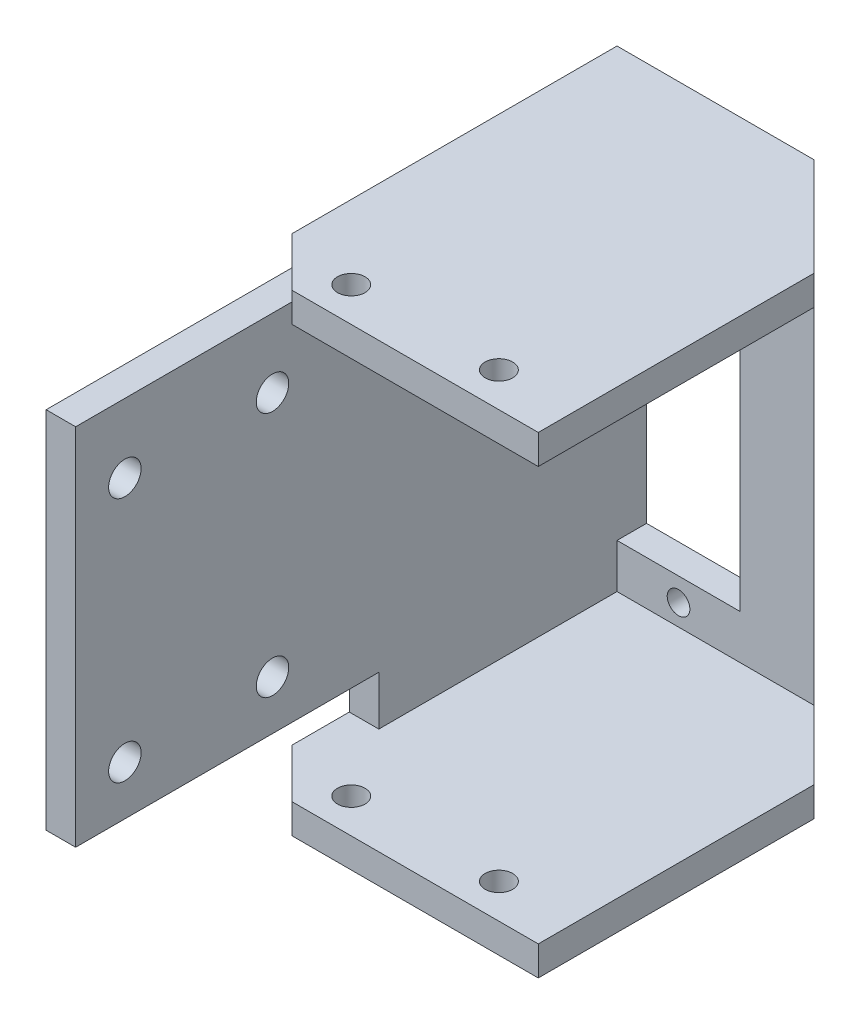
from build123d import *

# Parameters (mm, degrees)
SKETCH_1_W           = 30
SKETCH_1_H           = 48
EXTRUDE_1_DEPTH      = 3
SKETCH_3_W           = 30
SKETCH_3_H           = 3
EXTRUDE_2_DEPTH      = 35
CUT_EXTRUDE_2_DEPTH  = 69.176242196
CUT_EXTRUDE_3_DEPTH  = 69.176242196
SKETCH_7_W           = 3
SKETCH_7_H           = 42
EXTRUDE_3_DEPTH      = 25
SKETCH_14_W          = 3
SKETCH_14_H          = 42
EXTRUDE_6_DEPTH      = 30
SKETCH_15_R          = 1.65
CUT_EXTRUDE_6_DEPTH  = 4
SKETCH_16_R          = 1.15
SKETCH_16_W          = 12.5
SKETCH_16_H          = 23
CUT_EXTRUDE_7_DEPTH  = 10
SKETCH_17_W          = 30.8
SKETCH_17_H          = 5
CUT_EXTRUDE_8_DEPTH  = 10
SKETCH_20_R          = 1.4
CUT_EXTRUDE_11_DEPTH = 82.043198357
CUT_EXTRUDE_12_REACH = 83.043
SKETCH_22_R          = 2
SKETCH_23_W          = 5.554421841
SKETCH_23_H          = 4.674351411
SKETCH_23_R          = 2
EXTRUDE_9_DEPTH      = 3


with BuildPart() as part:
    # 草图1 → 凸台-拉伸1 (new body)
    with BuildSketch(Plane.XY):
        with Locations((15, 24)):
            Rectangle(SKETCH_1_W, SKETCH_1_H)
    extrude(amount=EXTRUDE_1_DEPTH)

    # 草图3 → 凸台-拉伸2 (add)
    with BuildSketch(Plane.XY.offset(3)):
        with Locations((15, 46.5)):
            Rectangle(SKETCH_3_W, SKETCH_3_H)
        with Locations((15, 1.5)):
            Rectangle(SKETCH_3_W, SKETCH_3_H)
    extrude(amount=EXTRUDE_2_DEPTH)

    # 草图5 → 切除-拉伸2 (cut, through all)
    with BuildSketch(Plane.XZ):
        Polygon((0, 33), (5, 38), (0, 38), align=None)
    extrude(amount=-CUT_EXTRUDE_2_DEPTH, mode=Mode.SUBTRACT)

    # 草图6 → 切除-拉伸3 (cut, through all)
    with BuildSketch(Plane.XZ):
        Polygon((20, 0), (30, 10), (30, 0), align=None)
    extrude(amount=-CUT_EXTRUDE_3_DEPTH, mode=Mode.SUBTRACT)

    # 草图7 → 凸台-拉伸3 (add)
    with BuildSketch(Plane.XY.offset(3)):
        with Locations((1.5, 24)):
            Rectangle(SKETCH_7_W, SKETCH_7_H)
    extrude(amount=EXTRUDE_3_DEPTH)

    # 草图14 → 凸台-拉伸6 (add)
    with BuildSketch(Plane.XY.offset(28)):
        with Locations((1.5, 24)):
            Rectangle(SKETCH_14_W, SKETCH_14_H)
    extrude(amount=EXTRUDE_6_DEPTH)

    # 草图15 → 切除-拉伸6 (cut)
    with BuildSketch(Plane.ZY):
        with Locations(Location((38, 13, 0), (0, 0, 270))):
            Circle(SKETCH_15_R)
        with Locations(Location((38, 38, 0), (0, 0, 270))):
            Circle(SKETCH_15_R)
        with Locations(Location((53, 38, 0), (0, 0, 270))):
            Circle(SKETCH_15_R)
        with Locations(Location((53, 13, 0), (0, 0, 270))):
            Circle(SKETCH_15_R)
    extrude(amount=-CUT_EXTRUDE_6_DEPTH, mode=Mode.SUBTRACT)

    # 草图16 → 切除-拉伸7 (cut)
    with BuildSketch(Plane.XY.offset(3)):
        with Locations((9.25, 32.85)):
            Circle(SKETCH_16_R)
        with Locations((9.25, 5.15)):
            Circle(SKETCH_16_R)
        with Locations((9.25, 19)):
            Rectangle(SKETCH_16_W, SKETCH_16_H)
    extrude(amount=-CUT_EXTRUDE_7_DEPTH, mode=Mode.SUBTRACT)

    # 草图17 → 切除-拉伸8 (cut)
    with BuildSketch(Plane.ZY):
        with Locations((42.6, 5.5)):
            Rectangle(SKETCH_17_W, SKETCH_17_H)
    extrude(amount=-CUT_EXTRUDE_8_DEPTH, mode=Mode.SUBTRACT)

    # 草图20 → 切除-拉伸11 (cut, through all)
    with BuildSketch(Plane.XZ):
        with Locations(Location((22.5, 34.5, 0), (0, 0, 270))):
            Circle(SKETCH_20_R)
        with Locations(Location((7.5, 34.5, 0), (0, 0, 270))):
            Circle(SKETCH_20_R)
    extrude(amount=-CUT_EXTRUDE_11_DEPTH, mode=Mode.SUBTRACT)

    # 草图22 → 切除-拉伸12 (cut, up to next)
    with BuildSketch(Plane(origin=(0, 0, 0), x_dir=(-1, 0, 0), z_dir=(0, 0, -1)), mode=Mode.PRIVATE) as cut_extrude_12_sk1:
        with Locations((-9.25, 37.75)):
            Circle(SKETCH_22_R)
    cut_extrude_12_tool1 = extrude(cut_extrude_12_sk1.sketch, amount=-CUT_EXTRUDE_12_REACH, mode=Mode.PRIVATE) & part.part
    add(cut_extrude_12_tool1.solids().sort_by_distance((9.25, 37.75, 0))[0], mode=Mode.SUBTRACT)

    # 草图23 → 凸台-拉伸9 (add)
    with BuildSketch(Plane.XY.offset(3)):
        with Locations((9.150966926, 37.89409872)):
            Rectangle(SKETCH_23_W, SKETCH_23_H)
        with Locations(Location((9.25, 37.75, 0), (0, 0, 180))):
            Circle(SKETCH_23_R, mode=Mode.SUBTRACT)
    extrude(amount=EXTRUDE_9_DEPTH)


solid = part.part
